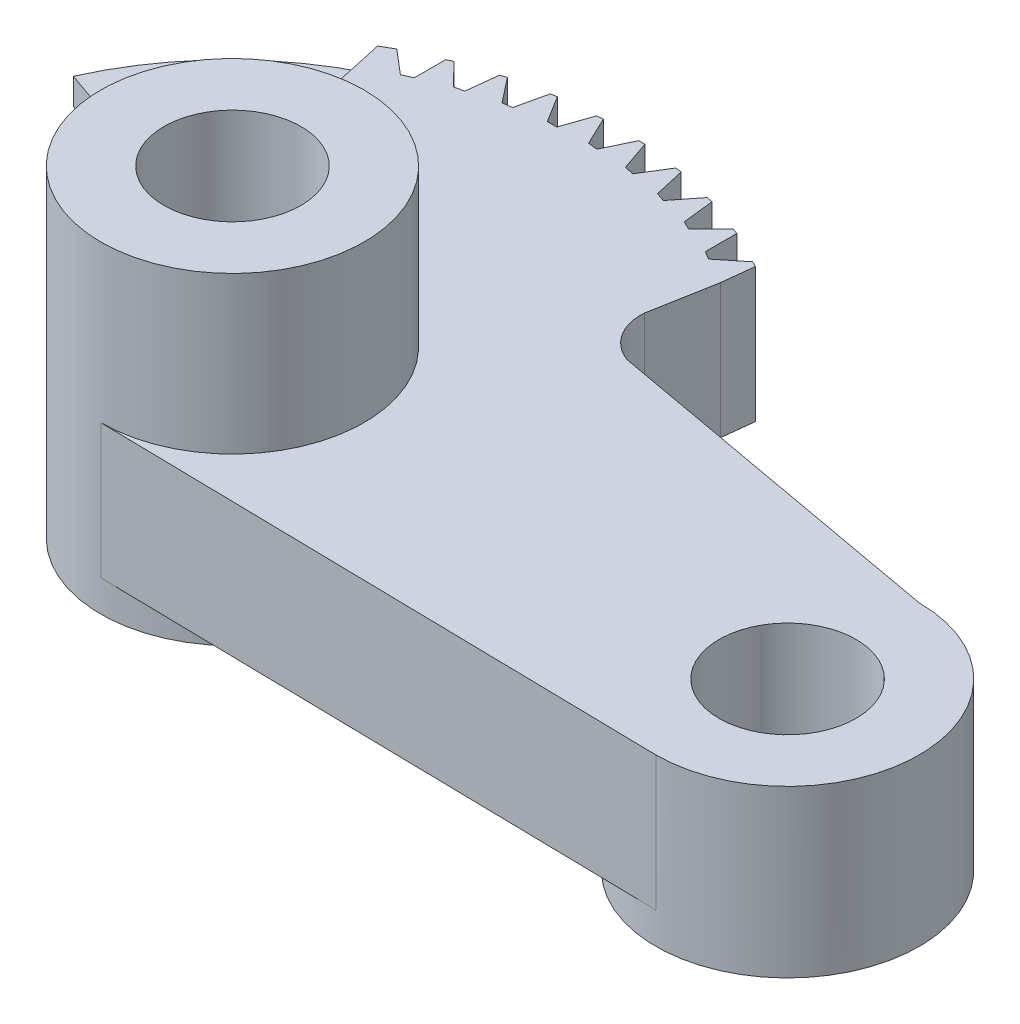
from build123d import *

# Parameters (mm, degrees)
SKETCH_1_R          = 2.4999999999999982
SKETCH_1_R_2        = 2.5000000000000027
EXTRUDE_1_DEPTH     = 5.1
SKETCH_2_R          = 4.999999999999998
SKETCH_2_R_2        = 2.5
EXTRUDE_2_DEPTH     = 5.94
CUT_EXTRUDE_1_DEPTH = 3.5
CUT_EXTRUDE_START   = -0.6
CUT_EXTRUDE_3_DEPTH = 0.6
EXTRUDE_START       = 1.2
SKETCH_6_R          = 4.999999999999998
SKETCH_6_R_2        = 2.5
SKETCH_6_R_3        = 5
SKETCH_6_R_4        = 2.4999999999999987
EXTRUDE_4_DEPTH     = 1.2
SKETCH_7_R          = 2.6000000000000005
CUT_EXTRUDE_4_DEPTH = 33.57721194023454
SKETCH_8_R          = 2.6
CUT_EXTRUDE_5_DEPTH = 31.8406734329677


with BuildPart() as part:
    # Эскиз1 → Бобышка-Вытянуть1 (new body)
    with BuildSketch(Plane(origin=(0, 0, 0), x_dir=(1, 0, 0), z_dir=(0, 1, 0))):
        with BuildLine():
            Line((6.718023264525762, 8.928267668376021), (7.161238337218641, 11.37785065819786))
            Line((7.161238337218641, 11.37785065819786), (7.294846288705666, 12.560700282216452))
            Line((7.294846288705666, 12.560700282216452), (7.085001061393901, 12.665407082864023))
            Line((7.085001061393901, 12.665407082864023), (6.15987792536569, 11.916319971156167))
            Line((6.15987792536569, 11.916319971156167), (5.853623131200735, 12.10383694173367))
            Line((5.853623131200735, 12.10383694173367), (5.855060736117009, 13.29420757772634))
            Line((5.855060736117009, 13.29420757772634), (5.634886528714601, 13.37496556136943))
            Line((5.634886528714601, 13.37496556136943), (4.798663389284832, 12.527784837542624))
            Line((4.798663389284832, 12.527784837542624), (4.473480547373511, 12.680135526842204))
            Line((4.473480547373511, 12.680135526842204), (4.342730025112913, 13.863304415323501))
            Line((4.342730025112913, 13.863304415323501), (4.114949999467502, 13.919114749889351))
            Line((4.114949999467502, 13.919114749889351), (3.3779694438823102, 12.984318526945106))
            Line((3.3779694438823102, 12.984318526945106), (3.0378804853992434, 13.099618628946285))
            Line((3.0378804853992434, 13.099618628946285), (2.776558986480811, 14.260952083189514))
            Line((2.776558986480811, 14.260952083189514), (2.54399037483231, 14.291124494483034))
            Line((2.54399037483231, 14.291124494483034), (1.9153675367628848, 13.280274532718662))
            Line((1.9153675367628848, 13.280274532718662), (1.56457875493138, 13.35709799101592))
            Line((1.56457875493138, 13.35709799101592), (1.175918359734634, 14.482232389631033))
            Line((1.175918359734634, 14.482232389631033), (0.9414376205823001, 14.486393698794194))
            Line((0.9414376205823001, 14.486393698794194), (0.4289474421954887, 13.411992407470256))
            Line((0.42894744219548875, 13.411992407470256), (0.07179746795026506, 13.449389053044667))
            Line((0.07179746795026506, 13.449389053044667), (-0.4393947883485354, 14.524408492330128))
            Line((-0.43939478834853546, 14.524408492330128), (-0.6728875469021285, 14.502507231398162))
            Line((-0.6728875469021285, 14.502507231398162), (-1.062906477097084, 13.377843036257644))
            Line((-1.062906477097084, 13.377843036257644), (-1.4220003362283888, 13.375350339371238))
            Line((-1.4220003362283888, 13.375350339371238), (-2.049401918098927, 14.386958748197415))
            Line((-2.049401918098927, 14.386958748197415), (-2.279018807507275, 14.33926579666565))
            Line((-2.279018807507275, 14.33926579666565), (-2.5417426516817105, 13.178248785832608))
            Line((-2.5417426516817105, 13.178248785832608), (-2.898339045786024, 13.13589757669542))
            Line((-2.898339045786024, 13.13589757669542), (-3.6341901158202092, 14.071583165165732))
            Line((-3.6341901158202092, 14.071583165165732), (-3.8570911851181764, 13.998688399693854))
            Line((-3.8570911851181764, 13.998688399693854), (-3.989270518385492, 12.815678280718325))
            Line((-3.989270518385492, 12.815678280718325), (-4.3389589867331635, 12.733992368173748))
            Line((-4.3389589867331635, 12.733992368173748), (-5.174158380979493, 13.582182376127184))
            Line((-5.174158380979493, 13.582182376127184), (-5.3875867419063175, 13.48498737481814))
            Line((-5.3875867419063175, 13.48498737481814), (-5.3875867419063175, 12.2946158707315))
            Line((-5.3875867419063175, 12.2946158707315), (-5.751610974482103, 12.12883970299033))
            Line((-5.751610974482103, 12.12883970299033), (-6.666748566138722, 12.905854249247858))
            Line((-6.666748566138722, 12.905854249247858), (-7.13096440438616, 12.63943472468846))
            Line((-7.13096440438616, 12.63943472468846), (-7.025830916712447, 12.175864106991055))
            ThreePointArc((-7.025830916712449, 12.175864106991055), (-10.264322646127633, 9.799709596012173), (-12.51111253150909, 6.470163958468902))
            Line((-12.51111253150909, 6.470163958468902), (-5.241071220187256, 3.924995297345621))
            Line((-5.241071220187256, 3.924995297345621), (-4.737733567637334, 1.5980865565051285))
            ThreePointArc((-4.737733567637334, 1.5980865565051288), (-4.061430338102922, -2.9162962141622684), (1.55e-15, -5))
            Line((2.2e-16, -5), (21.46693589645179, -5.388260461869603))
            ThreePointArc((21.46693589645179, -5.388260461869605), (26.46693589645179, -0.3882604618696045), (21.46693589645179, 4.611739538130397))
            Line((21.46693589645179, 4.611739538130397), (7.924308406385933, 7.062073595968816))
            ThreePointArc((7.924308406385932, 7.062073595968816), (7.00463576208043, 7.790569444059032), (6.718023264525762, 8.928267668376021))
        make_face()
        with Locations(Location((21.46693589645179, -0.38826046186960367, 0), (0, 0, 270))):
            Circle(SKETCH_1_R, mode=Mode.SUBTRACT)
        with Locations(Location((-2.78e-15, -1.44e-15, 0), (0, 0, 270))):
            Circle(SKETCH_1_R_2, mode=Mode.SUBTRACT)
    extrude(amount=EXTRUDE_1_DEPTH)

    # Эскиз2 → Бобышка-Вытянуть2 (add)
    with BuildSketch(Plane(origin=(0, 5.1, 0), x_dir=(1, 0, 0), z_dir=(0, 1, 0))):
        with Locations(Location((0, 0, 0), (0, 0, 270))):
            Circle(SKETCH_2_R)
        with Locations(Location((0, 0, 0), (0, 0, 270))):
            Circle(SKETCH_2_R_2, mode=Mode.SUBTRACT)
    extrude(amount=EXTRUDE_2_DEPTH)

    # Эскиз4 → Вырез-Вытянуть1 (cut)
    with BuildSketch(Plane.XZ):
        with BuildLine():
            Line((-5.241071220187255, -3.924995297345621), (-7.025830916712447, -12.175864106991055))
            ThreePointArc((-7.025830916712447, -12.175864106991055), (-10.264322646127628, -9.799709596012166), (-12.511112531509088, -6.470163958468901))
            Line((-12.511112531509088, -6.470163958468901), (-5.241071220187255, -3.924995297345621))
        make_face()
    extrude(amount=-CUT_EXTRUDE_1_DEPTH, mode=Mode.SUBTRACT)

    # Эскиз5 → Вырез-Вытянуть3 (cut)
    with BuildSketch(Plane(origin=(0, 5.1, 0), x_dir=(1, 0, 0), z_dir=(0, 1, 0)).offset(CUT_EXTRUDE_START)):
        with BuildLine():
            Line((-5.241071220187255, 3.924995297345621), (-7.025830916712447, 12.175864106991055))
            ThreePointArc((-7.025830916712447, 12.175864106991055), (-10.264322646127628, 9.799709596012168), (-12.511112531509088, 6.470163958468901))
            Line((-12.511112531509088, 6.470163958468901), (-5.241071220187255, 3.924995297345621))
        make_face()
    extrude(amount=CUT_EXTRUDE_3_DEPTH, mode=Mode.SUBTRACT)

    # Эскиз6 → Бобышка-Вытянуть4 (add)
    # profile 1 of 2: a face of its own
    with BuildSketch(Plane.XZ.offset(EXTRUDE_START)):
        with Locations(Location((0, 0, 0), (0, 0, 270))):
            Circle(SKETCH_6_R)
        with Locations(Location((0, 0, 0), (0, 0, 270))):
            Circle(SKETCH_6_R_2, mode=Mode.SUBTRACT)
    # profile 2 of 2: a face of its own
    with BuildSketch(Plane.XZ.offset(EXTRUDE_START)):
        with Locations(Location((21.46693589645179, 0.38826046186960295, 0), (0, 0, 270))):
            Circle(SKETCH_6_R_3)
        with Locations(Location((21.46693589645179, 0.38826046186960295, 0), (0, 0, 270))):
            Circle(SKETCH_6_R_4, mode=Mode.SUBTRACT)
    extrude(amount=-EXTRUDE_4_DEPTH)

    # Эскиз7 → Вырез-Вытянуть4 (cut, through all)
    with BuildSketch(Plane(origin=(0, 11.04, 0), x_dir=(1, 0, 0), z_dir=(0, 1, 0))):
        with Locations(Location((0, 0, 0), (0, 0, 270))):
            Circle(SKETCH_7_R)
    extrude(amount=-CUT_EXTRUDE_4_DEPTH, mode=Mode.SUBTRACT)

    # Эскиз8 → Вырез-Вытянуть5 (cut, through all)
    with BuildSketch(Plane(origin=(0, 5.1, 0), x_dir=(1, 0, 0), z_dir=(0, 1, 0))):
        with Locations(Location((21.46693589645179, -0.38826046186960295, 0), (0, 0, 270))):
            Circle(SKETCH_8_R)
    extrude(amount=-CUT_EXTRUDE_5_DEPTH, mode=Mode.SUBTRACT)


solid = part.part
